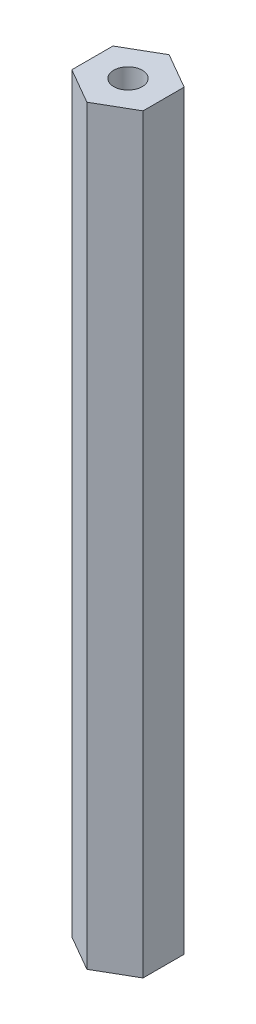
from build123d import *

# Parameters (mm, degrees)
SKETCH1_R           = 1.425
BOSS_EXTRUDE1_DEPTH = 75


with BuildPart() as part:
    # Sketch1 → Boss-Extrude1 (new body)
    with BuildSketch(Plane(origin=(0, 0, 0), x_dir=(1, 0, 0), z_dir=(0, 1, 0))):
        Polygon((0, 4.106115114), (-3.556, 2.053057557), (-3.556, -2.053057557), (0, -4.106115114), (3.556, -2.053057557), (3.556, 2.053057557), align=None)
        with Locations(Location((0, 0, 0), (0, 0, 270))):
            Circle(SKETCH1_R, mode=Mode.SUBTRACT)
    extrude(amount=BOSS_EXTRUDE1_DEPTH)


solid = part.part
